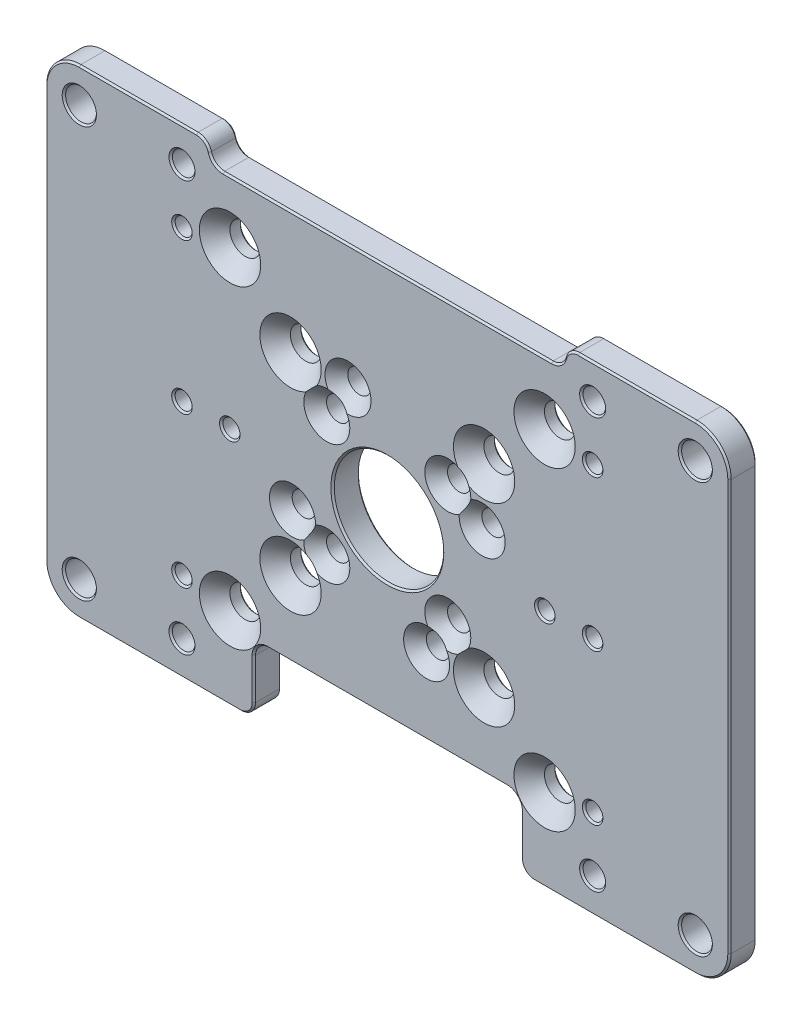
from build123d import *

# Parameters (mm, degrees)
SKETCH1_W                                       = 100
SKETCH1_H                                       = 70
BOSS_EXTRUDE1_DEPTH                             = 4
CUT_EXTRUDE1_DEPTH                              = 62.163714733
CUT_EXTRUDE2_DEPTH                              = 62.163714733
F_2_5_2_5_DIAMETER_HOLE1_D                      = 2.5
F_2_5_2_5_DIAMETER_HOLE2_D                      = 2.5
F_4_5_4_5_DIAMETER_HOLE1_D                      = 4.5
F_4_5_4_5_DIAMETER_HOLE2_D                      = 4.5
F_3_3_3_3_DIAMETER_HOLE1_D                      = 3.3
F_3_3_3_3_DIAMETER_HOLE2_D                      = 3.3
F_16_0_16_DIAMETER_HOLE1_D                      = 16
CSK_FOR_M3_FLAT_HEAD_MACHINE_SCREW1_D           = 3.4
CSK_FOR_M3_FLAT_HEAD_MACHINE_SCREW1_CSINK_D     = 6.72
CSK_FOR_M3_FLAT_HEAD_MACHINE_SCREW1_CSINK_ANGLE = 90
CSK_FOR_M4_FLAT_HEAD_MACHINE_SCREW1_AT_2_COUNT  = 2
CSK_FOR_M4_FLAT_HEAD_MACHINE_SCREW1_AT_2_PITCH  = 12.5
CSK_FOR_M4_FLAT_HEAD_MACHINE_SCREW1_AT_3_COUNT  = 2
CSK_FOR_M4_FLAT_HEAD_MACHINE_SCREW1_AT_3_PITCH  = 28.284271247
CSK_FOR_M4_FLAT_HEAD_MACHINE_SCREW1_AT_4_COUNT  = 2
CSK_FOR_M4_FLAT_HEAD_MACHINE_SCREW1_AT_4_PITCH  = 38.160843806
CSK_FOR_M4_FLAT_HEAD_MACHINE_SCREW1_AT_5_COUNT  = 2
CSK_FOR_M4_FLAT_HEAD_MACHINE_SCREW1_AT_5_PITCH  = 40
CSK_FOR_M4_FLAT_HEAD_MACHINE_SCREW1_AT_6_COUNT  = 2
CSK_FOR_M4_FLAT_HEAD_MACHINE_SCREW1_AT_6_PITCH  = 52.5
CSK_FOR_M4_FLAT_HEAD_MACHINE_SCREW1_AT_7_COUNT  = 2
CSK_FOR_M4_FLAT_HEAD_MACHINE_SCREW1_AT_7_PITCH  = 28.284271247
CSK_FOR_M4_FLAT_HEAD_MACHINE_SCREW1_AT_8_COUNT  = 2
CSK_FOR_M4_FLAT_HEAD_MACHINE_SCREW1_AT_8_PITCH  = 38.160843806
FILLET1_R                                       = 2
FILLET2_R                                       = 5
CHAMFER1_SIZE                                   = 0.25


with BuildPart() as part:
    # Sketch1 → Boss-Extrude1 (new body)
    with BuildSketch(Plane.XY):
        Rectangle(SKETCH1_W, SKETCH1_H)
    extrude(amount=-BOSS_EXTRUDE1_DEPTH)

    # Sketch2 → Cut-Extrude1 (cut, through all)
    with BuildSketch(Plane(origin=(0, 0, -4), x_dir=(-1, 0, 0), z_dir=(0, 0, -1))):
        with BuildLine():
            Line((27.872983346, 35), (-27.872983346, 35))
            ThreePointArc((-27.872983346, 35), (-26.648238475, 34.58113883), (-25.936491673, 33.5))
            ThreePointArc((-25.936491673, 33.5), (-25.224744871, 32.41886117), (-24, 32))
            Line((-24, 32), (24, 32))
            ThreePointArc((24, 32), (25.224744871, 32.41886117), (25.936491673, 33.5))
            ThreePointArc((25.936491673, 33.5), (26.648238475, 34.58113883), (27.872983346, 35))
        make_face()
    extrude(amount=-CUT_EXTRUDE1_DEPTH, mode=Mode.SUBTRACT)

    # Sketch3 → Cut-Extrude2 (cut, through all)
    with BuildSketch(Plane(origin=(0, 0, -4), x_dir=(-1, 0, 0), z_dir=(0, 0, -1))):
        with BuildLine():
            Line((-19.5, -35), (19.5, -35))
            Line((19.5, -35), (19.5, -27))
            ThreePointArc((19.5, -27), (18.914213562, -25.585786438), (17.5, -25))
            Line((17.5, -25), (-17.5, -25))
            ThreePointArc((-17.5, -25), (-18.914213562, -25.585786438), (-19.5, -27))
            Line((-19.5, -27), (-19.5, -35))
        make_face()
    extrude(amount=-CUT_EXTRUDE2_DEPTH, mode=Mode.SUBTRACT)

    # Ø2.5 (2.5) Diameter Hole1 (through all)
    with Locations(Plane(origin=(0, 0, -4), x_dir=(-1, 0, 0), z_dir=(0, 0, -1))):
        with Locations((-30, 22)):
            Hole(F_2_5_2_5_DIAMETER_HOLE1_D / 2)

    # Ø2.5 (2.5) Diameter Hole2 (through all)
    with Locations(Plane.XY):
        with Locations((23.0125, 0), (-23.0125, 0), (-30, 22), (30, 0), (30, -22), (-30, -22), (-30, 0)):
            Hole(F_2_5_2_5_DIAMETER_HOLE2_D / 2)

    # Ø4.5 (4.5) Diameter Hole1 (through all)
    with Locations(Plane.XY):
        with Locations((-45, 30), (45, -30)):
            Hole(F_4_5_4_5_DIAMETER_HOLE1_D / 2)

    # Ø4.5 (4.5) Diameter Hole2 (through all)
    with Locations(Plane(origin=(0, 0, -4), x_dir=(-1, 0, 0), z_dir=(0, 0, -1))):
        with Locations((45, -30), (-45, 30)):
            Hole(F_4_5_4_5_DIAMETER_HOLE2_D / 2)

    # Ø3.3 (3.3) Diameter Hole1 (through all)
    with Locations(Plane(origin=(0, 0, -4), x_dir=(-1, 0, 0), z_dir=(0, 0, -1))):
        with Locations((-30, -30)):
            Hole(F_3_3_3_3_DIAMETER_HOLE1_D / 2)

    # Ø3.3 (3.3) Diameter Hole2 (through all)
    with Locations(Plane.XY):
        with Locations((-30, 30), (-30, -30), (30, 30)):
            Hole(F_3_3_3_3_DIAMETER_HOLE2_D / 2)

    # Ø16.0 (16) Diameter Hole1 (through all)
    with Locations(Plane.XY):
        with Locations((0, 0)):
            Hole(F_16_0_16_DIAMETER_HOLE1_D / 2)

    # CSK for M3 Flat Head Machine Screw1 (through all)
    with Locations(Plane.XY):
        with Locations((-8.838834765, -8.838834765), (-13.858192988, -5.740251485), (-8.838834765, 8.838834765), (-5.740251485, 13.858192988), (8.838834765, 8.838834765), (13.858192988, 5.740251485), (8.838834765, -8.838834765), (5.740251485, -13.858192988)):
            CounterSinkHole(CSK_FOR_M3_FLAT_HEAD_MACHINE_SCREW1_D / 2, CSK_FOR_M3_FLAT_HEAD_MACHINE_SCREW1_CSINK_D / 2, counter_sink_angle=CSK_FOR_M3_FLAT_HEAD_MACHINE_SCREW1_CSINK_ANGLE)

    # Sketch20 → CSK for M4 Flat Head Machine Screw1 (revolve, cut)
    with BuildSketch(Plane(origin=(-14.142135624, -14.142135624, 0), x_dir=(0, -1, 0), z_dir=(1, 0, 0))):
        Polygon((0, 0), (0, 4), (2.25, 4), (2.25, 2.23), (4.48, 0), align=None)
    csk_for_m4_flat_head_machine_screw1 = revolve(axis=Axis((-14.142135624, -14.142135624, 6.35), (0, 0, -1)), mode=Mode.SUBTRACT)

    # CSK for M4 Flat Head Machine Screw1 at 2: CSK for M4 Flat Head Machine Screw1 ×2
    with Locations(*[Vector(-0.7071067811865483, -0.7071067811865468, 0) * (i * CSK_FOR_M4_FLAT_HEAD_MACHINE_SCREW1_AT_2_PITCH) for i in range(1, CSK_FOR_M4_FLAT_HEAD_MACHINE_SCREW1_AT_2_COUNT)]):
        add(csk_for_m4_flat_head_machine_screw1, mode=Mode.SUBTRACT)

    # CSK for M4 Flat Head Machine Screw1 at 3: CSK for M4 Flat Head Machine Screw1 ×2
    with Locations(*[(0, i * CSK_FOR_M4_FLAT_HEAD_MACHINE_SCREW1_AT_3_PITCH, 0) for i in range(1, CSK_FOR_M4_FLAT_HEAD_MACHINE_SCREW1_AT_3_COUNT)]):
        add(csk_for_m4_flat_head_machine_screw1, mode=Mode.SUBTRACT)

    # CSK for M4 Flat Head Machine Screw1 at 4: CSK for M4 Flat Head Machine Screw1 ×2
    with Locations(*[Vector(-0.23162052730604002, 0.9728062146853669, 0) * (i * CSK_FOR_M4_FLAT_HEAD_MACHINE_SCREW1_AT_4_PITCH) for i in range(1, CSK_FOR_M4_FLAT_HEAD_MACHINE_SCREW1_AT_4_COUNT)]):
        add(csk_for_m4_flat_head_machine_screw1, mode=Mode.SUBTRACT)

    # CSK for M4 Flat Head Machine Screw1 at 5: CSK for M4 Flat Head Machine Screw1 ×2
    with Locations(*[Vector(0.707106781186547, 0.707106781186548, 0) * (i * CSK_FOR_M4_FLAT_HEAD_MACHINE_SCREW1_AT_5_PITCH) for i in range(1, CSK_FOR_M4_FLAT_HEAD_MACHINE_SCREW1_AT_5_COUNT)]):
        add(csk_for_m4_flat_head_machine_screw1, mode=Mode.SUBTRACT)

    # CSK for M4 Flat Head Machine Screw1 at 6: CSK for M4 Flat Head Machine Screw1 ×2
    with Locations(*[Vector(0.7071067811865474, 0.7071067811865477, 0) * (i * CSK_FOR_M4_FLAT_HEAD_MACHINE_SCREW1_AT_6_PITCH) for i in range(1, CSK_FOR_M4_FLAT_HEAD_MACHINE_SCREW1_AT_6_COUNT)]):
        add(csk_for_m4_flat_head_machine_screw1, mode=Mode.SUBTRACT)

    # CSK for M4 Flat Head Machine Screw1 at 7: CSK for M4 Flat Head Machine Screw1 ×2
    with Locations(*[(i * CSK_FOR_M4_FLAT_HEAD_MACHINE_SCREW1_AT_7_PITCH, 0, 0) for i in range(1, CSK_FOR_M4_FLAT_HEAD_MACHINE_SCREW1_AT_7_COUNT)]):
        add(csk_for_m4_flat_head_machine_screw1, mode=Mode.SUBTRACT)

    # CSK for M4 Flat Head Machine Screw1 at 8: CSK for M4 Flat Head Machine Screw1 ×2
    with Locations(*[Vector(0.9728062146853669, -0.23162052730603966, 0) * (i * CSK_FOR_M4_FLAT_HEAD_MACHINE_SCREW1_AT_8_PITCH) for i in range(1, CSK_FOR_M4_FLAT_HEAD_MACHINE_SCREW1_AT_8_COUNT)]):
        add(csk_for_m4_flat_head_machine_screw1, mode=Mode.SUBTRACT)

    # Fillet1
    fillet1_edges = [part.edges().sort_by_distance(p)[0] for p in [
        (19.5, -35, -2),
        (-19.5, -35, -2),
    ]]
    fillet(fillet1_edges, radius=FILLET1_R)

    # Fillet2
    fillet2_edges = [part.edges().sort_by_distance(p)[0] for p in [
        (50, -35, -2),
        (-50, -35, -2),
        (-50, 35, -2),
        (50, 35, -2),
    ]]
    fillet(fillet2_edges, radius=FILLET2_R)

    # Chamfer1
    chamfer1_edges = [part.edges().sort_by_distance(p)[0] for p in [
        (24.2625, 0, 0),
        (24.2625, 0, -4),
        (47.25, -30, 0),
        (47.25, -30, -4),
        (-42.75, 30, 0),
        (-42.75, 30, -4),
        (42.75, 30, -4),
        (42.75, 30, 0),
        (-47.25, -30, -4),
        (-47.25, -30, 0),
        (28.35, -30, -4),
        (28.35, -30, 0),
        (31.65, 30, 0),
        (31.65, 30, -4),
        (-28.35, -30, 0),
        (-28.35, -30, -4),
        (-28.35, 30, 0),
        (-28.35, 30, -4),
        (8, 0, 0),
        (8, 0, -4),
        (-36.436491673, 35, 0),
        (7.440251485, -13.858192988, -4),
        (10.538834765, -8.838834765, -4),
        (15.558192988, 5.740251485, -4),
        (-36.436491673, 35, -4),
        (10.538834765, 8.838834765, -4),
        (-4.040251485, 13.858192988, -4),
        (-7.138834765, 8.838834765, -4),
        (-12.158192988, -5.740251485, -4),
        (-7.138834765, -8.838834765, -4),
        (-26.648238475, 34.58113883, 0),
        (-25.224744871, 32.41886117, 0),
        (0, 32, 0),
        (25.224744871, 32.41886117, 0),
        (22.980970389, -20.730970389, -4),
        (26.648238475, 34.58113883, 0),
        (14.142135624, -11.892135624, -4),
        (-26.648238475, 34.58113883, -4),
        (22.980970389, 25.230970389, -4),
        (26.648238475, 34.58113883, -4),
        (25.224744871, 32.41886117, -4),
        (0, 32, -4),
        (14.142135624, 16.392135624, -4),
        (-25.224744871, 32.41886117, -4),
        (-22.980970389, 25.230970389, -4),
        (-14.142135624, 16.392135624, -4),
        (-22.980970389, -20.730970389, -4),
        (-14.142135624, -11.892135624, -4),
        (33.25, -35, -4),
        (33.25, -35, 0),
        (-19.5, -30, -4),
        (-20.085786438, -34.414213562, -4),
        (20.085786438, -34.414213562, -4),
        (-19.5, -30, 0),
        (-20.085786438, -34.414213562, 0),
        (20.085786438, -34.414213562, 0),
        (50, 0, 0),
        (50, 0, -4),
        (36.436491673, 35, 0),
        (-50, 0, 0),
        (-33.25, -35, 0),
        (-48.535533906, -33.535533906, 0),
        (-48.535533906, 33.535533906, 0),
        (48.535533906, -33.535533906, 0),
        (48.535533906, 33.535533906, 0),
        (36.436491673, 35, -4),
        (-33.25, -35, -4),
        (-50, 0, -4),
        (-48.535533906, -33.535533906, -4),
        (-48.535533906, 33.535533906, -4),
        (48.535533906, -33.535533906, -4),
        (48.535533906, 33.535533906, -4),
        (19.5, -30, 0),
        (18.914213562, -25.585786438, 0),
        (0, -25, 0),
        (-18.914213562, -25.585786438, 0),
        (19.5, -30, -4),
        (-18.914213562, -25.585786438, -4),
        (0, -25, -4),
        (18.914213562, -25.585786438, -4),
        (28.75, 22, -4),
        (28.75, 22, 0),
        (-28.75, 0, 0),
        (-28.75, 0, -4),
        (-28.75, -22, 0),
        (-28.75, -22, -4),
        (31.25, -22, 0),
        (31.25, -22, -4),
        (31.25, 0, 0),
        (31.25, 0, -4),
        (-28.75, 22, 0),
        (-28.75, 22, -4),
        (-21.7625, 0, 0),
        (-21.7625, 0, -4),
    ]]
    chamfer(chamfer1_edges, length=CHAMFER1_SIZE)


solid = part.part
